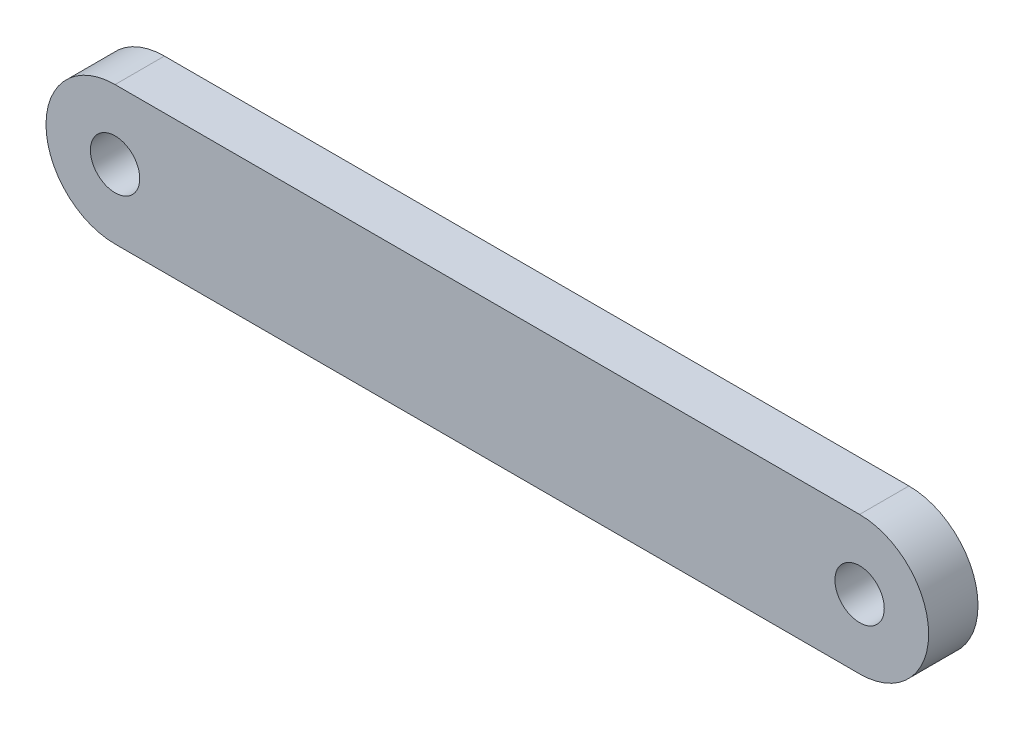
from build123d import *

# Parameters (mm, degrees)
SKETCH2_R           = 3.175
BOSS_EXTRUDE2_DEPTH = 6.35


with BuildPart() as part:
    # Sketch2 → Boss-Extrude2 (new body)
    with BuildSketch(Plane.XY):
        with BuildLine():
            Line((-63.195201668, -8.807106444), (32.638998332, -8.807106444))
            ThreePointArc((32.638998332, -8.807106444), (41.528998332, 0.082893556), (32.638998332, 8.972893556))
            Line((32.638998332, 8.972893556), (-63.195201668, 8.972893556))
            ThreePointArc((-63.195201668, 8.972893556), (-72.085201668, 0.082893556), (-63.195201668, -8.807106444))
        make_face()
        with Locations((-63.195201668, 0.082893556)):
            Circle(SKETCH2_R, mode=Mode.SUBTRACT)
        with Locations((32.638998332, 0.082893556)):
            Circle(SKETCH2_R, mode=Mode.SUBTRACT)
    extrude(amount=BOSS_EXTRUDE2_DEPTH)


solid = part.part
